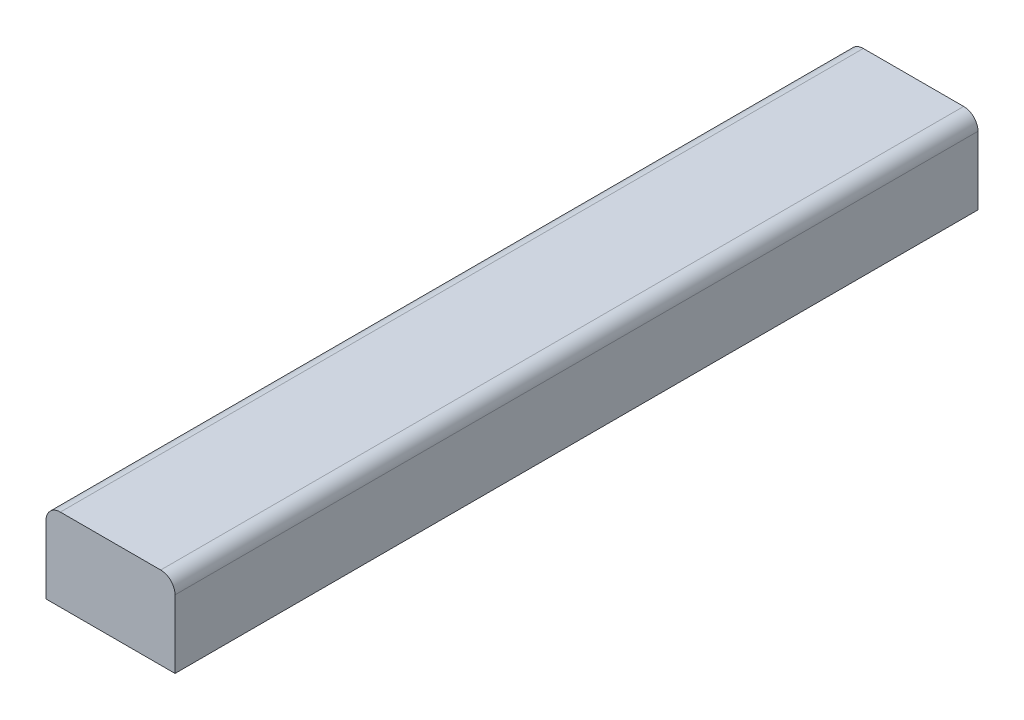
from build123d import *

# Parameters (mm, degrees)
SKETCH1_W           = 73.025
SKETCH1_H           = 114.3
BOSS_EXTRUDE1_DEPTH = 711.2
FILLET1_R           = 12.7


with BuildPart() as part:
    # Sketch1 → Boss-Extrude1 (new body)
    with BuildSketch(Plane(origin=(0, 0, 0), x_dir=(0, 1, 0), z_dir=(0, 0, 1))):
        Rectangle(SKETCH1_W, SKETCH1_H)
    extrude(amount=BOSS_EXTRUDE1_DEPTH)

    # Fillet1
    fillet1_edges = [part.edges().sort_by_distance(p)[0] for p in [
        (57.15, 36.5125, 355.6),
        (-57.15, 36.5125, 355.6),
    ]]
    fillet(fillet1_edges, radius=FILLET1_R)


solid = part.part
